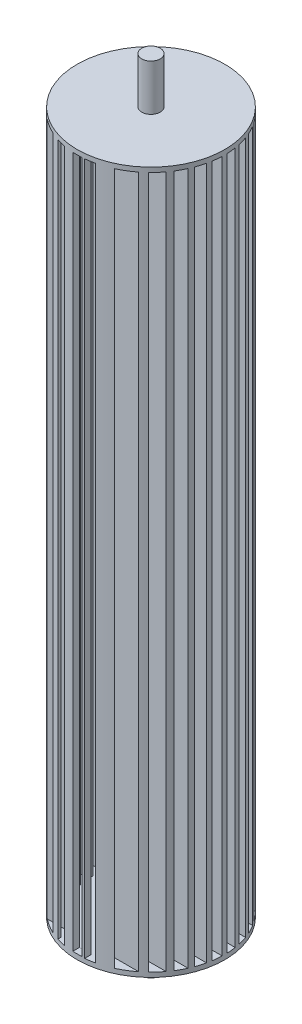
from build123d import *

# Parameters (mm, degrees)
SKETCH_1_R          = 80
EXTRUDE_1_DEPTH     = 760
CUT_EXTRUDE_START   = -5
SKETCH_2_R          = 65
CUT_EXTRUDE_1_DEPTH = 750
SKETCH_4_W          = 10
SKETCH_4_H          = 750
SKETCH_4_H_2        = 750.817396449
CUT_EXTRUDE_5_DEPTH = 781.768851838
SKETCH_5_W          = 10
SKETCH_5_H          = 750
SKETCH_5_H_2        = 749.429411824
CUT_EXTRUDE_6_DEPTH = 1100
SKETCH_6_R          = 10
EXTRUDE_2_DEPTH     = 50
EXTRUDE_START       = 50
SKETCH_7_R          = 10
EXTRUDE_3_DEPTH     = 50


with BuildPart() as part:
    # 草图1 → 凸台-拉伸1 (new body)
    with BuildSketch(Plane(origin=(0, 0, 0), x_dir=(1, 0, 0), z_dir=(0, 1, 0))):
        with Locations(Location((0, 0, 0), (0, 0, 270))):
            Circle(SKETCH_1_R)
    extrude(amount=EXTRUDE_1_DEPTH)

    # 草图2 → 切除-拉伸1 (cut)
    with BuildSketch(Plane(origin=(0, 760, 0), x_dir=(1, 0, 0), z_dir=(0, 1, 0)).offset(CUT_EXTRUDE_START)):
        with Locations(Location((0, 0, 0), (0, 0, 270))):
            Circle(SKETCH_2_R)
    extrude(amount=-CUT_EXTRUDE_1_DEPTH, mode=Mode.SUBTRACT)

    # 草图4 → 切除-拉伸5 (cut, through all)
    with BuildSketch(Plane(origin=(80, 0, 0), x_dir=(0, 0, -1), z_dir=(1, 0, 0))):
        with Locations((-67.815389673, 380)):
            Rectangle(SKETCH_4_W, SKETCH_4_H)
        with Locations((-52.815389673, 380)):
            Rectangle(SKETCH_4_W, SKETCH_4_H)
        with Locations((-37.815389673, 380)):
            Rectangle(SKETCH_4_W, SKETCH_4_H)
        with Locations((-7.815389673, 380)):
            Rectangle(SKETCH_4_W, SKETCH_4_H)
        with Locations((22.184610327, 380)):
            Rectangle(SKETCH_4_W, SKETCH_4_H)
        with Locations((52.184610327, 380)):
            Rectangle(SKETCH_4_W, SKETCH_4_H)
        with Locations((7.184610327, 380)):
            Rectangle(SKETCH_4_W, SKETCH_4_H)
        with Locations((37.184610327, 380)):
            Rectangle(SKETCH_4_W, SKETCH_4_H)
        with Locations((-22.815389673, 380)):
            Rectangle(SKETCH_4_W, SKETCH_4_H)
        with Locations((67.184610327, 379.591301776)):
            Rectangle(SKETCH_4_W, SKETCH_4_H_2)
    extrude(amount=-CUT_EXTRUDE_5_DEPTH, mode=Mode.SUBTRACT)

    # 草图5 → 切除-拉伸6 (cut)
    with BuildSketch(Plane.XY.offset(192.352939281)):
        with Locations((-19.871967952, 380)):
            Rectangle(SKETCH_5_W, SKETCH_5_H)
        with Locations((0.239093499, 380.285294088)):
            Rectangle(SKETCH_5_W, SKETCH_5_H_2)
        with Locations((12.740250466, 380)):
            Rectangle(SKETCH_5_W, SKETCH_5_H)
    extrude(amount=-CUT_EXTRUDE_6_DEPTH, mode=Mode.SUBTRACT)

    # 草图6 → 凸台-拉伸2 (add)
    with BuildSketch(Plane(origin=(0, 760, 0), x_dir=(1, 0, 0), z_dir=(0, 1, 0))):
        with Locations(Location((0, 0, 0), (0, 0, 270))):
            Circle(SKETCH_6_R)
    extrude(amount=EXTRUDE_2_DEPTH)

    # 草图7 → 凸台-拉伸3 (add)
    with BuildSketch(Plane.XZ.offset(EXTRUDE_START)):
        with Locations(Location((0, 0, 0), (0, 0, 90))):
            Circle(SKETCH_7_R)
    extrude(amount=-EXTRUDE_3_DEPTH)


solid = part.part
